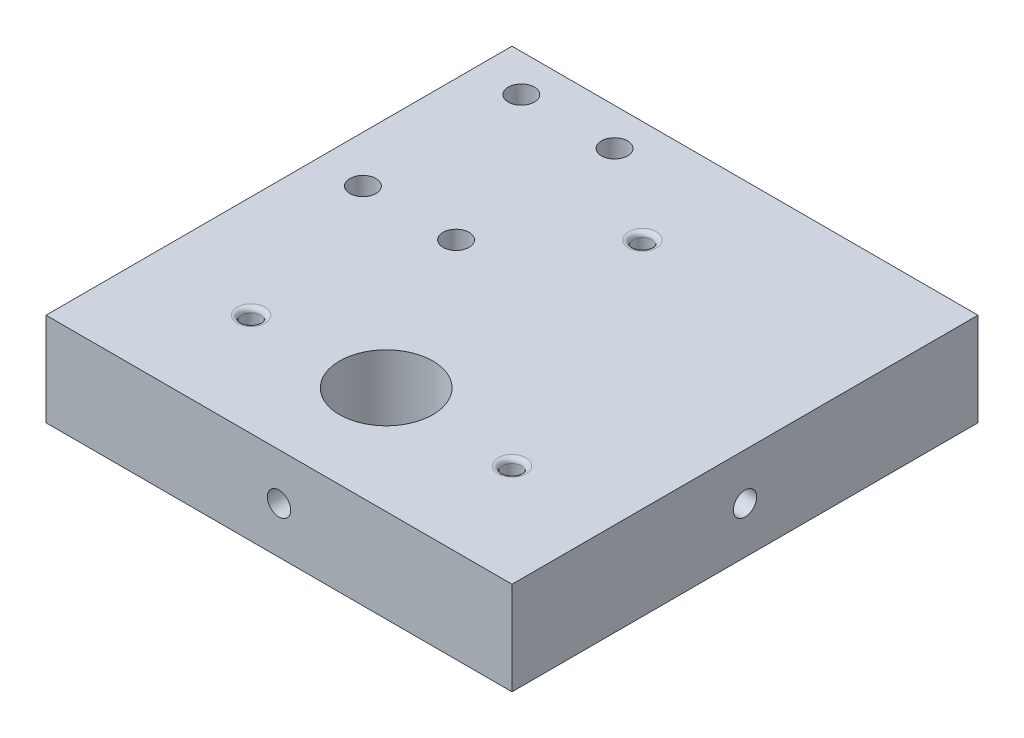
from build123d import *

# Parameters (mm, degrees)
SKETCH_1_W           = 50
SKETCH_1_H           = 50
EXTRUDE_1_DEPTH      = 10
SKETCH_6_R           = 10.1
CUT_EXTRUDE_4_DEPTH  = 2
SKETCH_7_R           = 5
CUT_EXTRUDE_5_DEPTH  = 72.161787499
SKETCH_10_R          = 1
CUT_EXTRUDE_6_DEPTH  = 2
SKETCH_11_R          = 1.25
CUT_EXTRUDE_7_DEPTH  = 8
SKETCH_12_R          = 1.4
CUT_EXTRUDE_8_DEPTH  = 5
FILLET_1_R           = 0.5
SKETCH_13_R          = 1.25
CUT_EXTRUDE_9_DEPTH  = 5
SKETCH_14_R          = 1.25
CUT_EXTRUDE_11_DEPTH = 6
CUT_EXTRUDE_START    = -6
SKETCH_15_R          = 1.25
CUT_EXTRUDE_12_DEPTH = 6
SKETCH_16_R          = 1.25
CUT_EXTRUDE_13_DEPTH = 6
SKETCH_17_R          = 1.25
CUT_EXTRUDE_14_DEPTH = 6


with BuildPart() as part:
    # 草图1 → 凸台-拉伸1 (new body)
    with BuildSketch(Plane(origin=(0, 0, 0), x_dir=(1, 0, 0), z_dir=(0, 1, 0))):
        with Locations((25, 25)):
            Rectangle(SKETCH_1_W, SKETCH_1_H)
    extrude(amount=EXTRUDE_1_DEPTH)

    # 草图6 → 切除-拉伸4 (cut)
    with BuildSketch(Plane(origin=(0, 0, 0), x_dir=(-1, 0, 0), z_dir=(0, -1, 0))):
        with Locations(Location((-25, 11.5, 0), (0, 0, 90))):
            Circle(SKETCH_6_R)
    extrude(amount=-CUT_EXTRUDE_4_DEPTH, mode=Mode.SUBTRACT)

    # 草图7 → 切除-拉伸5 (cut, through all)
    with BuildSketch(Plane(origin=(0, 2, 0), x_dir=(-1, 0, 0), z_dir=(0, -1, 0))):
        with Locations(Location((-25, 11.5, 0), (0, 0, 90))):
            Circle(SKETCH_7_R)
    extrude(amount=-CUT_EXTRUDE_5_DEPTH, mode=Mode.SUBTRACT)

    # 草图10 → 切除-拉伸6 (cut)
    with BuildSketch(Plane(origin=(0, 10, 0), x_dir=(1, 0, 0), z_dir=(0, 1, 0))):
        with Locations(Location((25, 39, 0), (0, 0, 270))):
            Circle(SKETCH_10_R)
        with Locations(Location((11, 11, 0), (0, 0, 270))):
            Circle(SKETCH_10_R)
        with Locations(Location((39, 11, 0), (0, 0, 270))):
            Circle(SKETCH_10_R)
    extrude(amount=-CUT_EXTRUDE_6_DEPTH, mode=Mode.SUBTRACT)

    # 草图11 → 切除-拉伸7 (cut)
    with BuildSketch(Plane(origin=(0, 0, 0), x_dir=(-1, 0, 0), z_dir=(0, -1, 0))):
        with Locations(Location((-40, 18.4, 0), (0, 0, 90))):
            Circle(SKETCH_11_R)
        with Locations(Location((-40, 4.6, 0), (0, 0, 90))):
            Circle(SKETCH_11_R)
        with Locations(Location((-10, 18.4, 0), (0, 0, 90))):
            Circle(SKETCH_11_R)
        with Locations(Location((-10, 4.6, 0), (0, 0, 90))):
            Circle(SKETCH_11_R)
    extrude(amount=-CUT_EXTRUDE_7_DEPTH, mode=Mode.SUBTRACT)

    # 草图12 → 切除-拉伸8 (cut)
    with BuildSketch(Plane(origin=(0, 10, 0), x_dir=(1, 0, 0), z_dir=(0, 1, 0))):
        with Locations(Location((15, 29, 0), (0, 0, 270))):
            Circle(SKETCH_12_R)
        with Locations(Location((5, 29, 0), (0, 0, 270))):
            Circle(SKETCH_12_R)
        with Locations(Location((15, 46, 0), (0, 0, 270))):
            Circle(SKETCH_12_R)
        with Locations(Location((5, 46, 0), (0, 0, 270))):
            Circle(SKETCH_12_R)
    extrude(amount=-CUT_EXTRUDE_8_DEPTH, mode=Mode.SUBTRACT)

    # 圆角1
    fillet_1_edges = [part.edges().sort_by_distance(p)[0] for p in [
        (25, 10, -40),
        (11, 10, -12),
        (39, 10, -12),
    ]]
    fillet(fillet_1_edges, radius=FILLET_1_R)

    # 草图13 → 切除-拉伸9 (cut)
    with BuildSketch(Plane(origin=(0, 0, 0), x_dir=(-1, 0, 0), z_dir=(0, -1, 0))):
        with Locations(Location((-17.5, 29, 0), (0, 0, 90))):
            Circle(SKETCH_13_R)
        with Locations(Location((-32.5, 29, 0), (0, 0, 90))):
            Circle(SKETCH_13_R)
        with Locations(Location((-17.5, 45, 0), (0, 0, 90))):
            Circle(SKETCH_13_R)
        with Locations(Location((-32.5, 45, 0), (0, 0, 90))):
            Circle(SKETCH_13_R)
    extrude(amount=-CUT_EXTRUDE_9_DEPTH, mode=Mode.SUBTRACT)

    # 草图14 → 切除-拉伸11 (cut)
    with BuildSketch(Plane.ZY):
        with Locations((-25.000214672, 5)):
            Circle(SKETCH_14_R)
    extrude(amount=-CUT_EXTRUDE_11_DEPTH, mode=Mode.SUBTRACT)

    # 草图15 → 切除-拉伸12 (cut)
    with BuildSketch(Plane(origin=(50, 0, 0), x_dir=(0, 0, -1), z_dir=(1, 0, 0)).offset(CUT_EXTRUDE_START)):
        with Locations(Location((25.000214672, 5, 0), (0, 0, 180))):
            Circle(SKETCH_15_R)
    extrude(amount=CUT_EXTRUDE_12_DEPTH, mode=Mode.SUBTRACT)

    # 草图16 → 切除-拉伸13 (cut)
    with BuildSketch(Plane(origin=(0, 0, -50), x_dir=(-1, 0, 0), z_dir=(0, 0, -1))):
        with Locations((-25, 5)):
            Circle(SKETCH_16_R)
    extrude(amount=-CUT_EXTRUDE_13_DEPTH, mode=Mode.SUBTRACT)

    # 草图17 → 切除-拉伸14 (cut)
    with BuildSketch(Plane.XY.offset(CUT_EXTRUDE_START)):
        with Locations(Location((25, 5, 0), (0, 0, 180))):
            Circle(SKETCH_17_R)
    extrude(amount=CUT_EXTRUDE_14_DEPTH, mode=Mode.SUBTRACT)


solid = part.part
